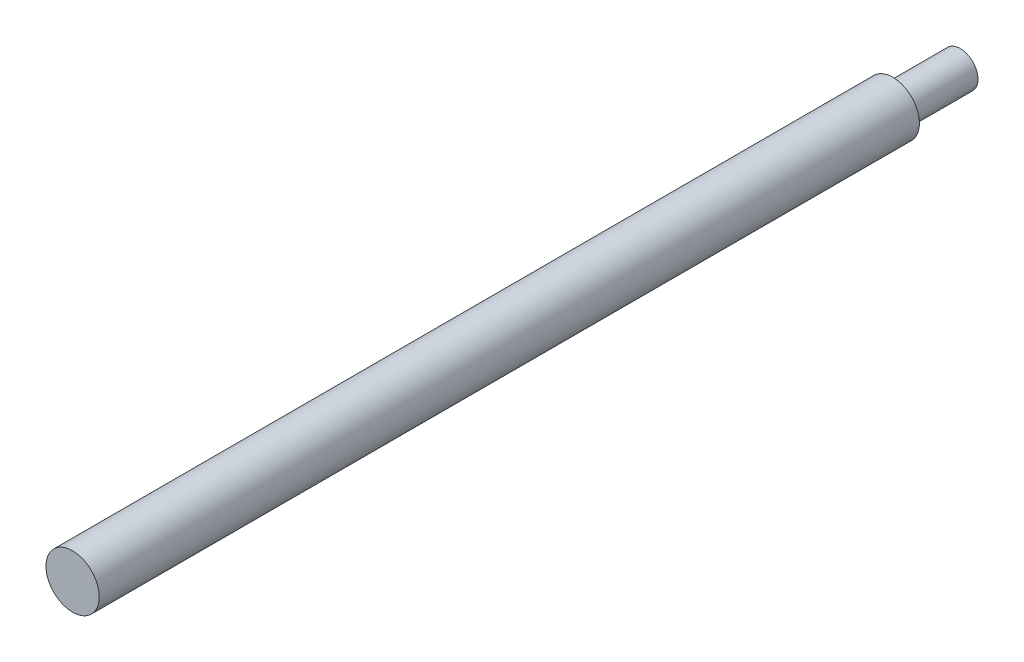
from build123d import *

# Parameters (mm, degrees)
SKETCH1_R           = 7.5
BOSS_EXTRUDE1_DEPTH = 250
SKETCH2_R           = 8.322710713
SKETCH2_R_2         = 5
CUT_EXTRUDE1_DEPTH  = 19


with BuildPart() as part:
    # Sketch1 → Boss-Extrude1 (new body)
    with BuildSketch(Plane.XY):
        Circle(SKETCH1_R)
    extrude(amount=BOSS_EXTRUDE1_DEPTH)

    # Sketch2 → Cut-Extrude1 (cut)
    with BuildSketch(Plane.XY):
        Circle(SKETCH2_R)
        Circle(SKETCH2_R_2, mode=Mode.SUBTRACT)
    extrude(amount=CUT_EXTRUDE1_DEPTH, mode=Mode.SUBTRACT)


solid = part.part
